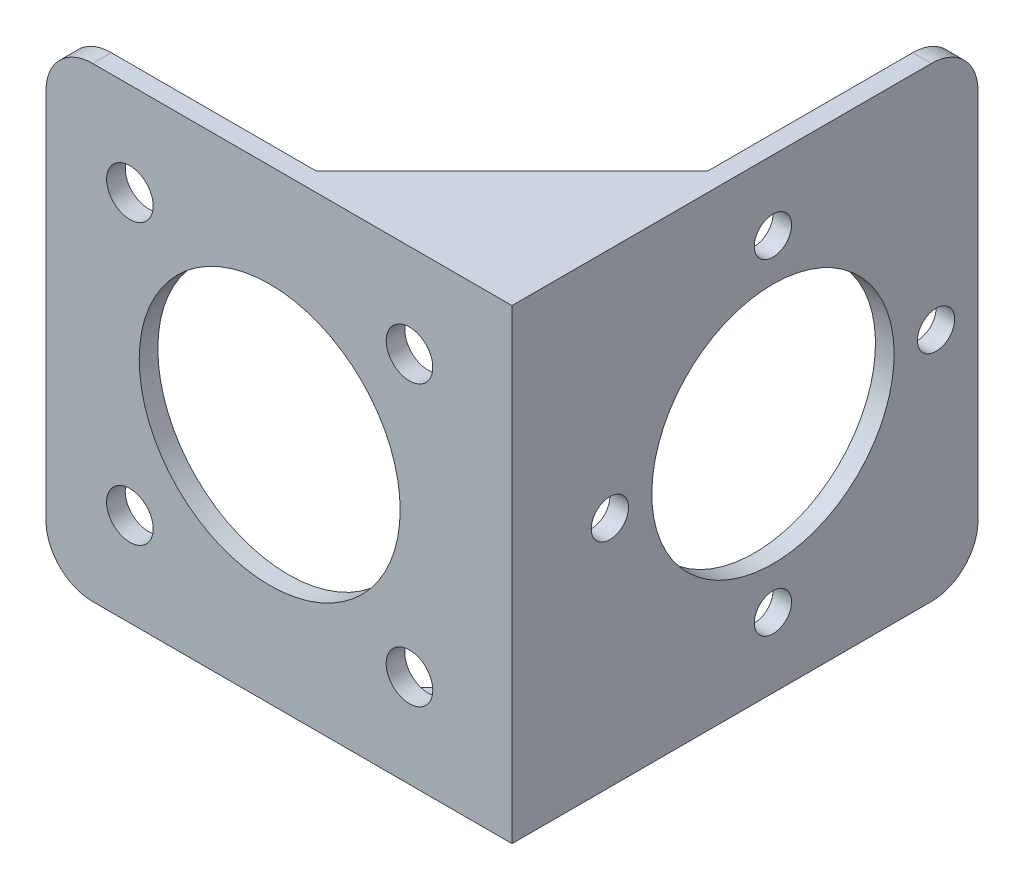
from build123d import *

# Parameters (mm, degrees)
SKETCH_1_W          = 50
SKETCH_1_H          = 50
SKETCH_1_R          = 14
SKETCH_1_R_2        = 2.5
EXTRUDE_1_DEPTH     = 2
SKETCH_3_W          = 2
SKETCH_3_H          = 50
EXTRUDE_3_DEPTH     = 48
EXTRUDE_4_DEPTH     = 2
EXTRUDE_5_DEPTH     = 2
SKETCH_6_R          = 13
SKETCH_6_R_2        = 2
CUT_EXTRUDE_1_DEPTH = 2
FILLET_1_R          = 5


with BuildPart() as part:
    # 草图1 → 凸台-拉伸1 (new body)
    with BuildSketch(Plane.XY):
        Rectangle(SKETCH_1_W, SKETCH_1_H)
        with Locations((-1, 0)):
            Circle(SKETCH_1_R, mode=Mode.SUBTRACT)
        with Locations((-16, 15)):
            Circle(SKETCH_1_R_2, mode=Mode.SUBTRACT)
        with Locations(Location((-16, -15, 0), (0, 0, 180))):
            Circle(SKETCH_1_R_2, mode=Mode.SUBTRACT)
        with Locations((14, -15)):
            Circle(SKETCH_1_R_2, mode=Mode.SUBTRACT)
        with Locations(Location((14, 15, 0), (0, 0, 180))):
            Circle(SKETCH_1_R_2, mode=Mode.SUBTRACT)
    extrude(amount=EXTRUDE_1_DEPTH)

    # 草图3 → 凸台-拉伸3 (add)
    with BuildSketch(Plane(origin=(0, 0, 0), x_dir=(-1, 0, 0), z_dir=(0, 0, -1))):
        with Locations((-24, 0)):
            Rectangle(SKETCH_3_W, SKETCH_3_H)
    extrude(amount=EXTRUDE_3_DEPTH)

    # 草图4 → 凸台-拉伸4 (add)
    with BuildSketch(Plane(origin=(0, 25, 0), x_dir=(1, 0, 0), z_dir=(0, 1, 0))):
        Polygon((0, -2), (25, 23), (25, -2), align=None)
    extrude(amount=-EXTRUDE_4_DEPTH)

    # 草图5 → 凸台-拉伸5 (add)
    with BuildSketch(Plane.XZ.offset(25)):
        Polygon((25, 2), (0, 2), (25, -23), align=None)
    extrude(amount=-EXTRUDE_5_DEPTH)

    # 草图6 → 切除-拉伸1 (cut)
    with BuildSketch(Plane(origin=(25, 0, 0), x_dir=(0, 0, -1), z_dir=(1, 0, 0))):
        with Locations(Location((26, 0, 0), (0, 0, 90))):
            Circle(SKETCH_6_R)
        with Locations(Location((43.5, 0, 0), (0, 0, 90))):
            Circle(SKETCH_6_R_2)
        with Locations(Location((26, 17.5, 0), (0, 0, 90))):
            Circle(SKETCH_6_R_2)
        with Locations(Location((26, -17.5, 0), (0, 0, 270))):
            Circle(SKETCH_6_R_2)
        with Locations(Location((8.5, 0, 0), (0, 0, 270))):
            Circle(SKETCH_6_R_2)
    extrude(amount=-CUT_EXTRUDE_1_DEPTH, mode=Mode.SUBTRACT)

    # 圆角1
    fillet_1_edges = [part.edges().sort_by_distance(p)[0] for p in [
        (24, -25, -48),
        (24, 25, -48),
        (-25, -25, 1),
        (-25, 25, 1),
    ]]
    fillet(fillet_1_edges, radius=FILLET_1_R)


solid = part.part
